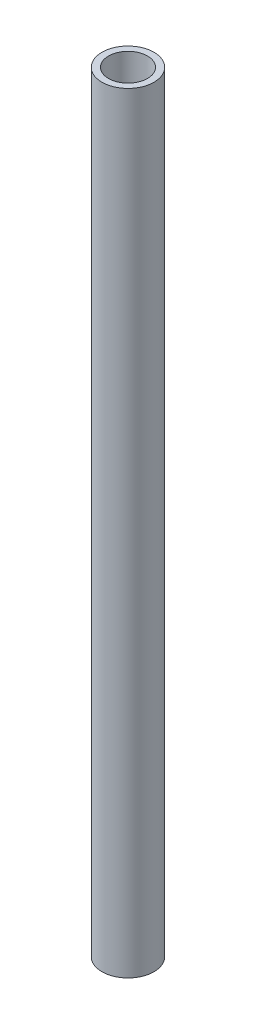
from build123d import *

# Parameters (mm, degrees)
SKETCH1_R           = 4
SKETCH1_R_2         = 3
BOSS_EXTRUDE1_DEPTH = 59.25775


with BuildPart() as part:
    # Sketch1 → Boss-Extrude1 (new, symmetric)
    with BuildSketch(Plane(origin=(0, 0, 0), x_dir=(1, 0, 0), z_dir=(0, 1, 0))):
        with Locations(Location((0, 0, 0), (0, 0, 270))):
            Circle(SKETCH1_R)
        with Locations(Location((0, 0, 0), (0, 0, 270))):
            Circle(SKETCH1_R_2, mode=Mode.SUBTRACT)
    extrude(amount=BOSS_EXTRUDE1_DEPTH, both=True)


solid = part.part
